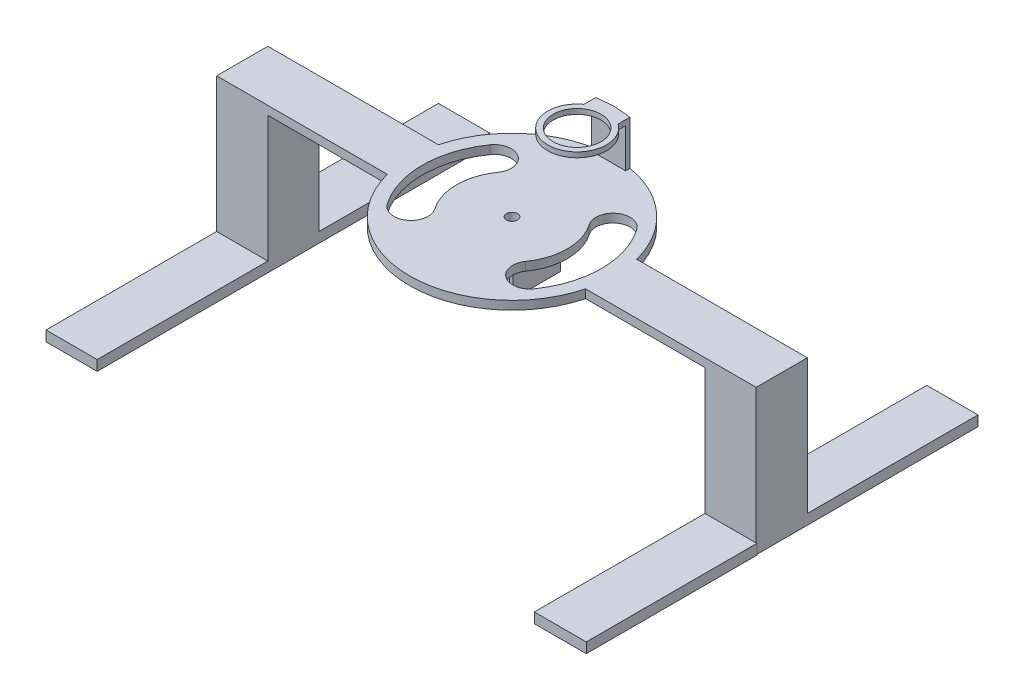
from build123d import *

# Parameters (mm, degrees)
SKETCH1_R            = 60
BOSS_EXTRUDE1_DEPTH  = 5
CUT_EXTRUDE1_DEPTH   = 5
BOSS_EXTRUDE2_DEPTH  = 23
SKETCH4_R            = 3.25
CUT_EXTRUDE2_DEPTH   = 15
BOSS_EXTRUDE3_START  = -5
BOSS_EXTRUDE3_DEPTH  = 5
SKETCH6_W            = 30
SKETCH6_H            = 30
BOSS_EXTRUDE4_DEPTH  = 80
SKETCH10_R           = 14
BOSS_EXTRUDE6_DEPTH  = 3
SKETCH7_W            = 18
SKETCH7_H            = 28
BOSS_EXTRUDE9_DEPTH  = 28
SKETCH15_W           = 14
SKETCH15_H           = 26
CUT_EXTRUDE3_DEPTH   = 26
SKETCH16_W           = 14
SKETCH16_H           = 10
CUT_EXTRUDE4_DEPTH   = 2
SKETCH12_W           = 30
SKETCH12_H           = 100
BOSS_EXTRUDE11_DEPTH = 6
SKETCH17_R           = 3.5
CUT_EXTRUDE5_DEPTH   = 1.5


with BuildPart() as part:
    # Sketch1 → Boss-Extrude1 (new body)
    with BuildSketch(Plane(origin=(0, 0, 0), x_dir=(1, 0, 0), z_dir=(0, 1, 0))):
        with Locations(Location((0, 0, 0), (0, 0, 270))):
            Circle(SKETCH1_R)
    extrude(amount=BOSS_EXTRUDE1_DEPTH)

    # Sketch2 → Cut-Extrude1 (cut)
    with BuildSketch(Plane(origin=(0, 5, 0), x_dir=(1, 0, 0), z_dir=(0, 1, 0))):
        with BuildLine():
            ThreePointArc((-43.005482325, 30.112762908), (-52.5, 0), (-43.005482325, -30.112762908))
            ThreePointArc((-43.005482325, -30.112762908), (-29.078197519, -32.568518988), (-26.622441439, -18.641234181))
            ThreePointArc((-26.622441439, -18.641234181), (-32.5, 0), (-26.622441439, 18.641234181))
            ThreePointArc((-26.622441439, 18.641234181), (-29.078197519, 32.568518988), (-43.005482325, 30.112762908))
        make_face()
        with BuildLine():
            ThreePointArc((43.005482325, 30.112762908), (29.078197519, 32.568518988), (26.622441439, 18.641234181))
            ThreePointArc((26.622441439, 18.641234181), (32.5, 0), (26.622441439, -18.641234181))
            ThreePointArc((26.622441439, -18.641234181), (29.078197519, -32.568518988), (43.005482325, -30.112762908))
            ThreePointArc((43.005482325, -30.112762908), (52.5, 0), (43.005482325, 30.112762908))
        make_face()
    extrude(amount=-CUT_EXTRUDE1_DEPTH, mode=Mode.SUBTRACT)

    # Sketch3 → Boss-Extrude2 (add)
    with BuildSketch(Plane(origin=(0, 5, 0), x_dir=(1, 0, 0), z_dir=(0, 1, 0))):
        with BuildLine():
            Line((10, 56.623758265), (10, 59.160797831))
            ThreePointArc((10, 59.160797831), (0, 60), (-10, 59.160797831))
            Line((-10, 59.160797831), (-10, 56.623758265))
            Line((-10, 56.623758265), (10, 56.623758265))
        make_face()
    extrude(amount=BOSS_EXTRUDE2_DEPTH)

    # Sketch4 → Cut-Extrude2 (cut)
    with BuildSketch(Plane(origin=(0, 5, 0), x_dir=(1, 0, 0), z_dir=(0, 1, 0))):
        with Locations(Location((0, 0, 0), (0, 0, 270))):
            Circle(SKETCH4_R)
    extrude(amount=-CUT_EXTRUDE2_DEPTH, mode=Mode.SUBTRACT)

    # Sketch5 → Boss-Extrude3 (add)
    with BuildSketch(Plane(origin=(0, 5, 0), x_dir=(1, 0, 0), z_dir=(0, 1, 0)).offset(BOSS_EXTRUDE3_START)):
        with BuildLine():
            Line((-58.094750193, 15), (-158.094750193, 15))
            Line((-158.094750193, 15), (-158.094750193, -15))
            Line((-158.094750193, -15), (-58.094750193, -15))
            ThreePointArc((-58.094750193, -15), (-60, 0), (-58.094750193, 15))
        make_face()
    boss_extrude3 = extrude(amount=BOSS_EXTRUDE3_DEPTH)

    # Mirror1: Boss-Extrude3 across plane
    add(boss_extrude3.mirror(Plane(origin=(0, 0, 0), x_dir=(0, 0, 1), z_dir=(1, 0, 0))))

    # Sketch6 → Boss-Extrude4 (add)
    with BuildSketch(Plane.XZ):
        with Locations((-143.094750193, 0)):
            Rectangle(SKETCH6_W, SKETCH6_H)
    boss_extrude4 = extrude(amount=BOSS_EXTRUDE4_DEPTH)

    # Mirror2: Boss-Extrude4 across plane
    add(boss_extrude4.mirror(Plane(origin=(0, 0, 0), x_dir=(0, 0, 1), z_dir=(1, 0, 0))))

    # Sketch10 → Boss-Extrude6 (add)
    with BuildSketch(Plane(origin=(0, 28, 0), x_dir=(1, 0, 0), z_dir=(0, 1, 0))):
        with BuildLine():
            Line((-10, 59.160797831), (-10, 52.168042812))
            ThreePointArc((-10, 52.168042812), (0, 20.973758265), (10, 52.168042812))
            Line((10, 52.168042812), (10, 59.160797831))
            Line((10, 59.160797831), (0, 60))
            Line((0, 60), (-10, 59.160797831))
        make_face()
        with Locations(Location((0, 38.173758265, 0), (0, 0, 270))):
            Circle(SKETCH10_R, mode=Mode.SUBTRACT)
    extrude(amount=BOSS_EXTRUDE6_DEPTH)

    # Sketch7 → Boss-Extrude9 (add)
    with BuildSketch(Plane.XZ):
        with Locations((0, -5.5)):
            Rectangle(SKETCH7_W, SKETCH7_H)
    extrude(amount=BOSS_EXTRUDE9_DEPTH)

    # Sketch15 → Cut-Extrude3 (cut)
    with BuildSketch(Plane.XY.offset(8.5)):
        with Locations((0, -13)):
            Rectangle(SKETCH15_W, SKETCH15_H)
    extrude(amount=-CUT_EXTRUDE3_DEPTH, mode=Mode.SUBTRACT)

    # Sketch16 → Cut-Extrude4 (cut)
    with BuildSketch(Plane.XY.offset(-17.5)):
        with Locations((0, -5)):
            Rectangle(SKETCH16_W, SKETCH16_H)
    extrude(amount=-CUT_EXTRUDE4_DEPTH, mode=Mode.SUBTRACT)

    # Sketch12 → Boss-Extrude11 (add)
    with BuildSketch(Plane.XZ.offset(80)):
        Polygon((128.094750193, 115), (128.094750193, 15), (158.094750193, 15), (158.516628994, 15), (158.516628994, 115), align=None)
        with Locations((143.094750193, -65)):
            Rectangle(SKETCH12_W, SKETCH12_H)
        with Locations((-143.094750193, 65)):
            Rectangle(SKETCH12_W, SKETCH12_H)
        with Locations((-143.094750193, -65)):
            Rectangle(SKETCH12_W, SKETCH12_H)
    extrude(amount=-BOSS_EXTRUDE11_DEPTH)

    # Sketch17 → Cut-Extrude5 (cut)
    with BuildSketch(Plane(origin=(0, 0, -60), x_dir=(-1, 0, 0), z_dir=(0, 0, -1))):
        with Locations((0, 15)):
            Circle(SKETCH17_R)
    extrude(amount=-CUT_EXTRUDE5_DEPTH, mode=Mode.SUBTRACT)


solid = part.part
